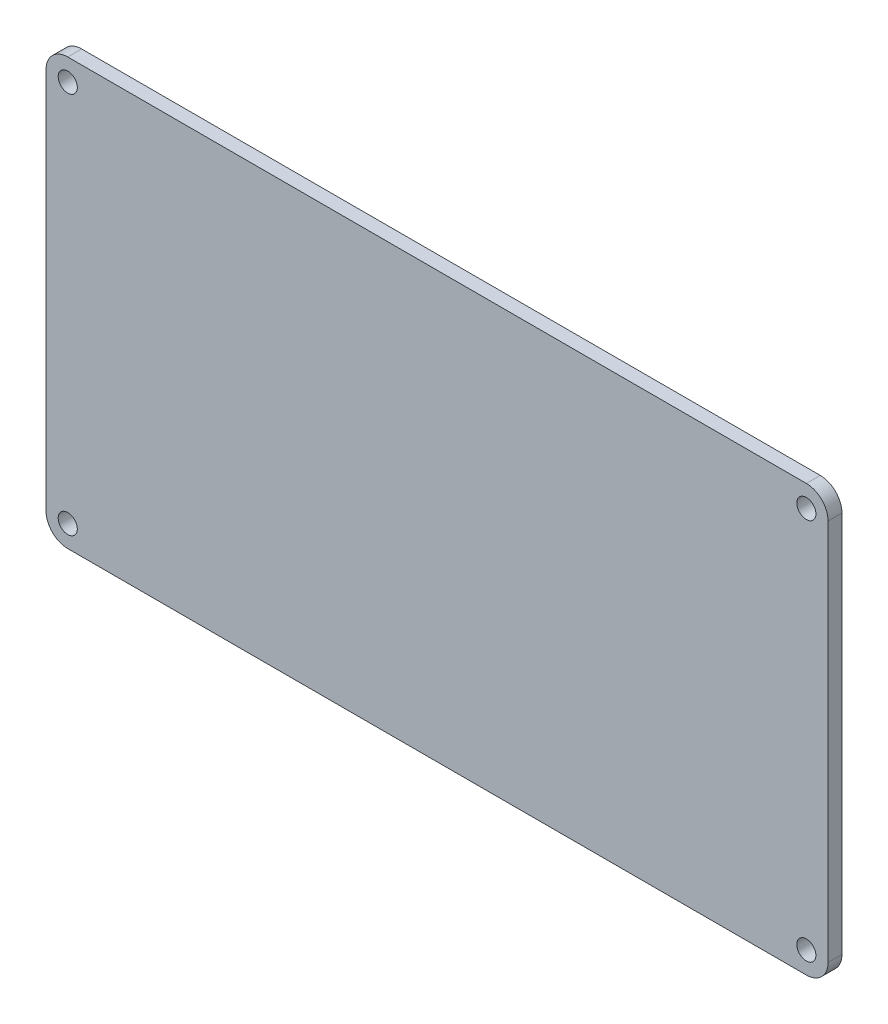
from build123d import *

# Parameters (mm, degrees)
SKETCH_1_W          = 90
SKETCH_1_H          = 49
EXTRUDE_1_DEPTH     = 1.6
FILLET_1_R          = 2.5
SKETCH_2_R          = 1.1
CUT_EXTRUDE_1_DEPTH = 26.6


with BuildPart() as part:
    # 草图1 → 凸台-拉伸1 (new body)
    with BuildSketch(Plane.XY):
        Rectangle(SKETCH_1_W, SKETCH_1_H)
    extrude(amount=EXTRUDE_1_DEPTH)

    # 圆角1
    fillet_1_edges = [part.edges().sort_by_distance(p)[0] for p in [
        (45, -24.5, 0.8),
        (-45, -24.5, 0.8),
        (-45, 24.5, 0.8),
        (45, 24.5, 0.8),
    ]]
    fillet(fillet_1_edges, radius=FILLET_1_R)

    # 草图2 → 切除-拉伸1 (cut)
    with BuildSketch(Plane(origin=(0, 0, 0), x_dir=(-1, 0, 0), z_dir=(0, 0, -1))):
        with Locations((-42.5, -22)):
            Circle(SKETCH_2_R)
        with Locations((-42.5, 22)):
            Circle(SKETCH_2_R)
        with Locations((42.5, 22)):
            Circle(SKETCH_2_R)
        with Locations((42.5, -22)):
            Circle(SKETCH_2_R)
    extrude(amount=-CUT_EXTRUDE_1_DEPTH, mode=Mode.SUBTRACT)


solid = part.part
